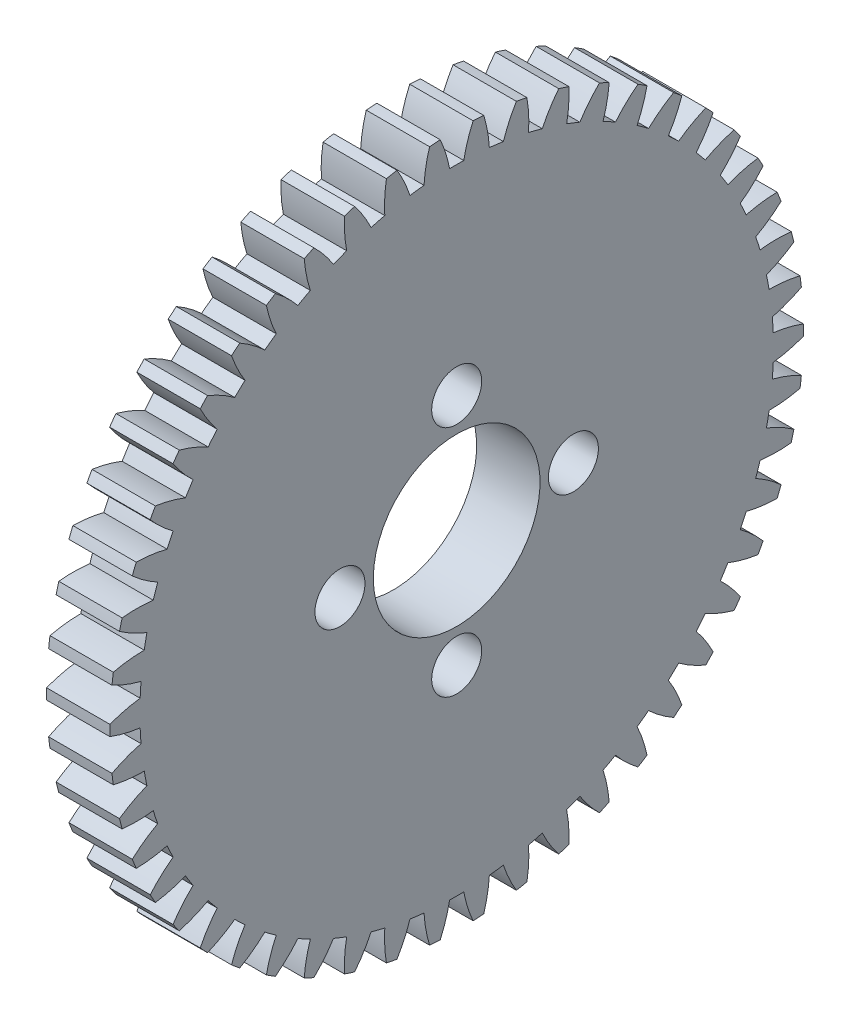
from build123d import *

# Parameters (mm, degrees)
BASPROSKE_W         = 3.8
BASPROSKE_H         = 20.8
TOOTHCUT_DEPTH      = 30.660074174
TEETHCUTS_COUNT     = 50
TEETHCUTS_ANGLE     = 352.8
BORSKE_R            = 0.4
BORE_DEPTH          = 50.0000508
SKETCH_1_R          = 5
SKETCH_1_R_2        = 1.5
CUT_EXTRUDE_1_DEPTH = 3.8


with BuildPart() as part:
    # BasProSke → Base-Revolve (revolve)
    with BuildSketch(Plane(origin=(0, 0, 0), x_dir=(1, 0, 0), z_dir=(0, 1, 0)), mode=Mode.PRIVATE) as base_revolve_sk:
        with Locations((1.9, 10.4)):
            Rectangle(BASPROSKE_W, BASPROSKE_H)
    revolve(base_revolve_sk.sketch.rotate(Axis((-10, 0, 0), (1, 0, 0)), 180), axis=Axis((-10, 0, 0), (1, 0, 0)))

    # TooCutSke → ToothCut (cut, through all)
    with BuildSketch(Plane(origin=(0, 0, 0), x_dir=(0, 0, -1), z_dir=(1, 0, 0))):
        with BuildLine():
            ThreePointArc((0.42481828, 18.994249931), (0, 18.999), (-0.42481828, 18.994249931))
            ThreePointArc((-0.42481828, 18.994249931), (-0.657054226, 19.914891238), (-0.996728369, 20.801534023))
            ThreePointArc((-0.996728369, 20.801534023), (0, 20.8254), (0.996728369, 20.801534023))
            ThreePointArc((0.996728369, 20.801534023), (0.657054226, 19.914891238), (0.42481828, 18.994249931))
        make_face()
    toothcut = extrude(amount=TOOTHCUT_DEPTH, mode=Mode.SUBTRACT)

    # TeethCuts: ToothCut ×50 about axis
    teethcuts_axis = Axis((-10, 0, 0), (1, 0, 0))
    for i in range(1, TEETHCUTS_COUNT):
        add(toothcut.rotate(teethcuts_axis, i * TEETHCUTS_ANGLE / (TEETHCUTS_COUNT - 1)), mode=Mode.SUBTRACT)

    # BorSke → Bore (cut, symmetric)
    with BuildSketch(Plane(origin=(0, 0, 0), x_dir=(0, 0, -1), z_dir=(1, 0, 0))):
        with Locations(Location((0, 0, 0), (0, 0, 180))):
            Circle(BORSKE_R)
    extrude(amount=BORE_DEPTH, both=True, mode=Mode.SUBTRACT)

    # 草图1 → 切除-拉伸1 (cut)
    with BuildSketch(Plane.ZY):
        Circle(SKETCH_1_R)
        with Locations((0, 7)):
            Circle(SKETCH_1_R_2)
        with Locations((-7, 0)):
            Circle(SKETCH_1_R_2)
        with Locations((0, -7)):
            Circle(SKETCH_1_R_2)
        with Locations((7, 0)):
            Circle(SKETCH_1_R_2)
    extrude(amount=-CUT_EXTRUDE_1_DEPTH, mode=Mode.SUBTRACT)


solid = part.part
